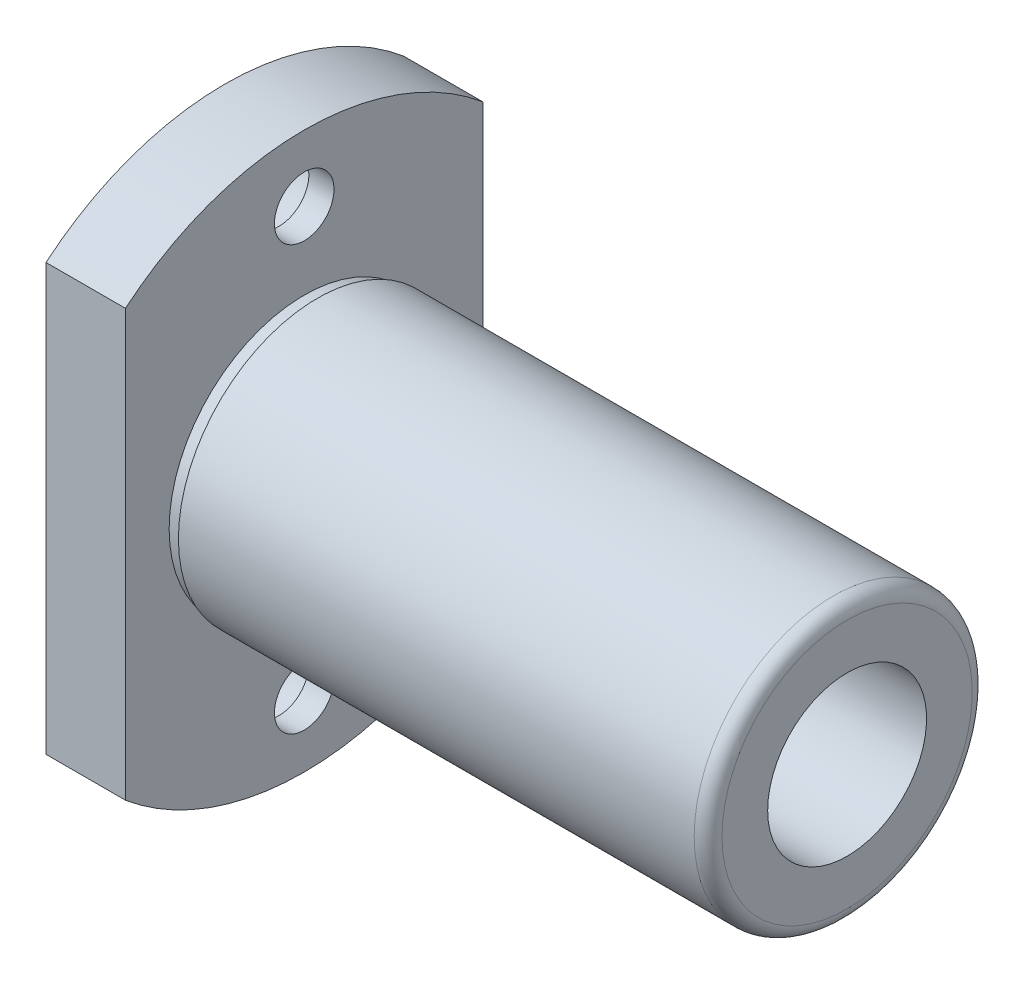
from build123d import *

# Parameters (mm, degrees)
SKETCH2_W          = 84
SKETCH2_H          = 84
CUT_EXTRUDE1_DEPTH = 6


with BuildPart() as part:
    # Sketch1 → Revolve1 (revolve)
    with BuildSketch(Plane.XY, mode=Mode.PRIVATE) as revolve1_sk:
        with BuildLine():
            Line((0, 21), (0, 6))
            Line((0, 6), (47, 6))
            Line((47, 6), (47, 9.45))
            ThreePointArc((47, 9.45), (46.69246212, 10.19246212), (45.95, 10.5))
            Line((45.95, 10.5), (7, 10.5))
            Line((7, 10.5), (7, 10.2))
            Line((7, 10.2), (6, 10.2))
            Line((6, 10.2), (6, 21))
            Line((6, 21), (0, 21))
        make_face()
    revolve(revolve1_sk.sketch.rotate(Axis((47, 0, 0), (-1, 0, 0)), 270), axis=Axis((47, 0, 0), (-1, 0, 0)))

    # Sketch2 → Cut-Extrude1 (cut)
    with BuildSketch(Plane(origin=(0, 0, 0), x_dir=(0, 0, -1), z_dir=(1, 0, 0))):
        Rectangle(SKETCH2_W, SKETCH2_H)
        with BuildLine():
            Line((13.5, -16.085707942), (13.5, 16.085707942))
            ThreePointArc((13.5, 16.085707942), (0, 21), (-13.5, 16.085707942))
            Line((-13.5, 16.085707942), (-13.5, -16.085707942))
            ThreePointArc((-13.5, -16.085707942), (0, -21), (13.5, -16.085707942))
        make_face(mode=Mode.SUBTRACT)
    extrude(amount=CUT_EXTRUDE1_DEPTH, mode=Mode.SUBTRACT)

    # Sketch3 → Cut-Revolve1 (revolve, cut)
    with BuildSketch(Plane.XY, mode=Mode.PRIVATE) as cut_revolve1_sk:
        Polygon((0, 16), (0, 19.75), (4.1, 19.75), (4.1, 18.25), (6, 18.25), (6, 16), align=None)
    revolve(cut_revolve1_sk.sketch.rotate(Axis((6, 16, 0), (-1, 0, 0)), 270), axis=Axis((6, 16, 0), (-1, 0, 0)), mode=Mode.SUBTRACT)

    # Sketch4 → Cut-Revolve2 (revolve, cut)
    with BuildSketch(Plane.XY, mode=Mode.PRIVATE) as cut_revolve2_sk:
        Polygon((0, -16), (0, -12.25), (4.1, -12.25), (4.1, -13.75), (6, -13.75), (6, -16), align=None)
    revolve(cut_revolve2_sk.sketch.rotate(Axis((6, -16, 0), (-1, 0, 0)), 270), axis=Axis((6, -16, 0), (-1, 0, 0)), mode=Mode.SUBTRACT)


solid = part.part
